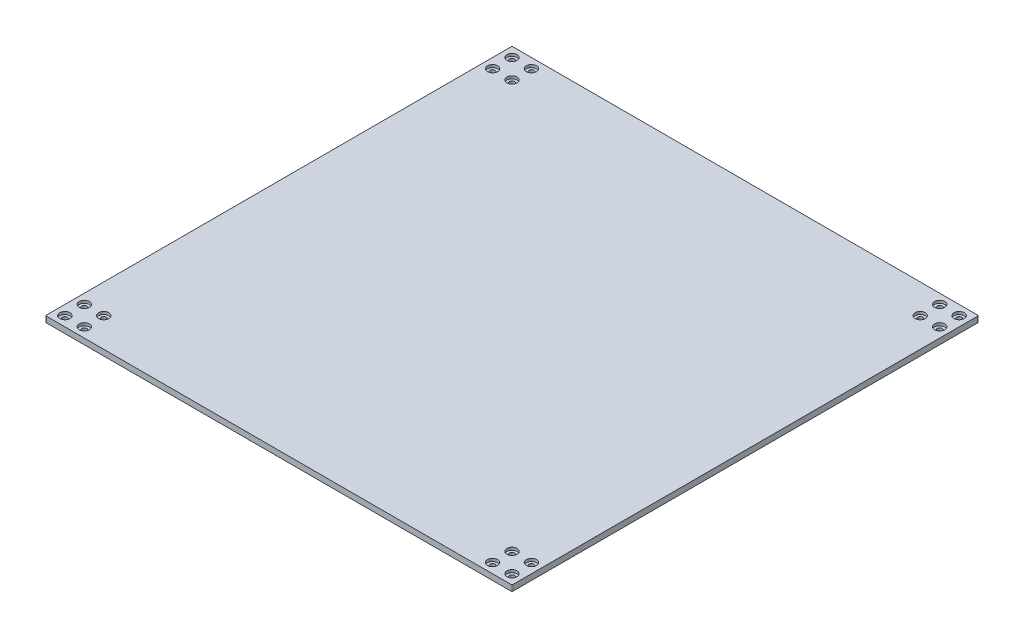
from build123d import *

# Parameters (mm, degrees)
SKETCH1_W                       = 480
SKETCH1_H                       = 480
BOSS_EXTRUDE1_DEPTH             = 6
CBORE_FOR_M5_SBHCS1_D           = 5.3
CBORE_FOR_M5_SBHCS1_CBORE_D     = 10.5
CBORE_FOR_M5_SBHCS1_CBORE_DEPTH = 2.75
CIRPATTERN1_COUNT               = 4
FILLET1_R                       = 1


with BuildPart() as part:
    # Sketch1 → Boss-Extrude1 (new body)
    with BuildSketch(Plane(origin=(0, 0, 0), x_dir=(1, 0, 0), z_dir=(0, 1, 0))):
        Rectangle(SKETCH1_W, SKETCH1_H)
    extrude(amount=BOSS_EXTRUDE1_DEPTH)

    # CBORE for M5 SBHCS1 (through all)
    with Locations(Plane(origin=(0, 6, 0), x_dir=(1, 0, 0), z_dir=(0, 1, 0))):
        with Locations((-230, 230), (-210, 230), (-210, 210), (-230, 210)):
            cbore_for_m5_sbhcs1 = CounterBoreHole(CBORE_FOR_M5_SBHCS1_D / 2, CBORE_FOR_M5_SBHCS1_CBORE_D / 2, CBORE_FOR_M5_SBHCS1_CBORE_DEPTH)

    # CirPattern1: CBORE for M5 SBHCS1 ×4 about axis
    cirpattern1_axis = Axis((0, 8.4, 0), (0, -1, 0))
    for i in range(1, CIRPATTERN1_COUNT):
        add(cbore_for_m5_sbhcs1.rotate(cirpattern1_axis, i * 360 / CIRPATTERN1_COUNT), mode=Mode.SUBTRACT)

    # Fillet1
    fillet1_edges = [part.edges().sort_by_distance(p)[0] for p in [
        (-240, 3, -240),
        (240, 3, -240),
        (240, 3, 240),
        (-240, 3, 240),
    ]]
    fillet(fillet1_edges, radius=FILLET1_R)


solid = part.part
